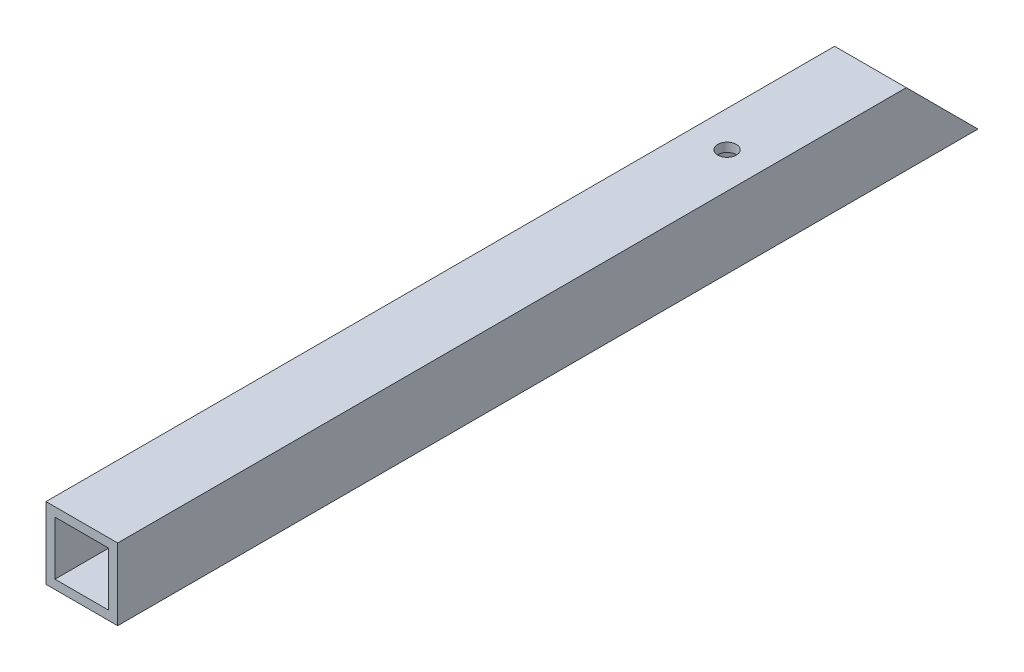
from build123d import *

# Parameters (mm, degrees)
SKETCH1_W           = 25.4
SKETCH1_H           = 25.4
SKETCH1_W_2         = 19.05
SKETCH1_H_2         = 19.05
BOSS_EXTRUDE1_DEPTH = 304.8
CUT_EXTRUDE1_DEPTH  = 307.120058147
SKETCH3_R           = 3.302
CUT_EXTRUDE2_DEPTH  = 307.120058147


with BuildPart() as part:
    # Sketch1 → Boss-Extrude1 (new body)
    with BuildSketch(Plane.XY):
        Rectangle(SKETCH1_W, SKETCH1_H)
        Rectangle(SKETCH1_W_2, SKETCH1_H_2, mode=Mode.SUBTRACT)
    extrude(amount=BOSS_EXTRUDE1_DEPTH)

    # Sketch2 → Cut-Extrude1 (cut, through all)
    with BuildSketch(Plane(origin=(12.7, 0, 0), x_dir=(0, 0, -1), z_dir=(1, 0, 0))):
        Polygon((0, 12.7), (0, -12.7), (-25.4, 12.7), align=None)
    extrude(amount=-CUT_EXTRUDE1_DEPTH, mode=Mode.SUBTRACT)

    # Sketch3 → Cut-Extrude2 (cut, through all)
    with BuildSketch(Plane(origin=(0, 12.7, 0), x_dir=(1, 0, 0), z_dir=(0, 1, 0))):
        with Locations(Location((0, -76.2, 0), (0, 0, 180))):
            Circle(SKETCH3_R)
    extrude(amount=-CUT_EXTRUDE2_DEPTH, mode=Mode.SUBTRACT)


solid = part.part
